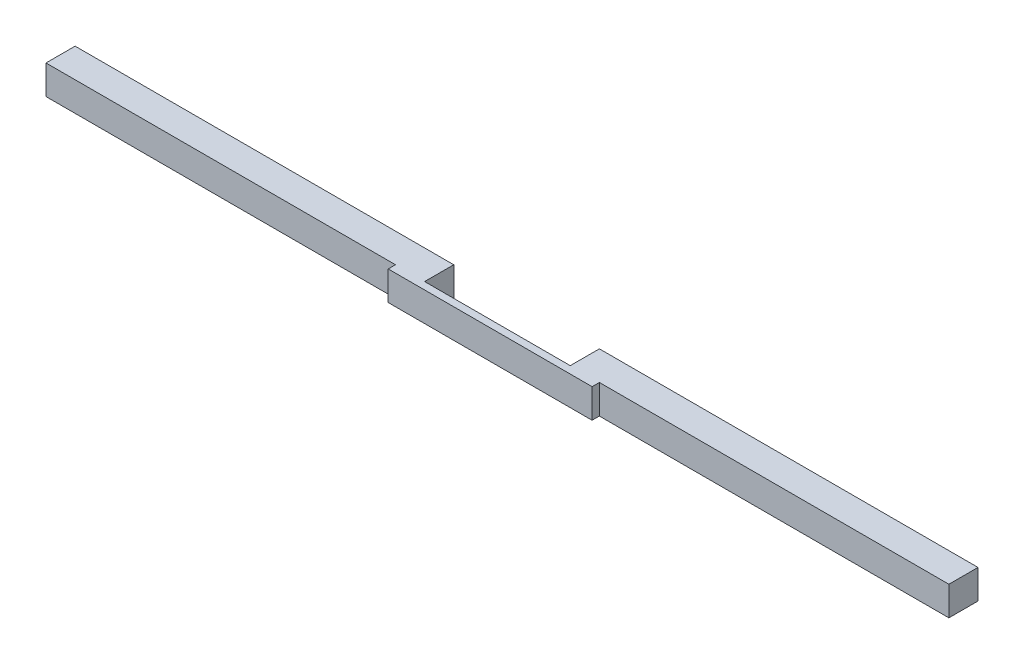
from build123d import *

# Parameters (mm, degrees)
BOSS_EXTRUDE1_DEPTH = 25.4


with BuildPart() as part:
    # Sketch1 → Boss-Extrude1 (new body)
    with BuildSketch(Plane(origin=(0, 0, 0), x_dir=(1, 0, 0), z_dir=(0, 1, 0))):
        Polygon((330.2, 0), (330.2, 25.4), (0, 25.4), (0, 0), (304.8, 0), (304.8, -6.35), (482.6, -6.35), (482.6, 0), (787.4, 0), (787.4, 25.4), (457.2, 25.4), (457.2, 0), align=None)
    extrude(amount=BOSS_EXTRUDE1_DEPTH)


solid = part.part
